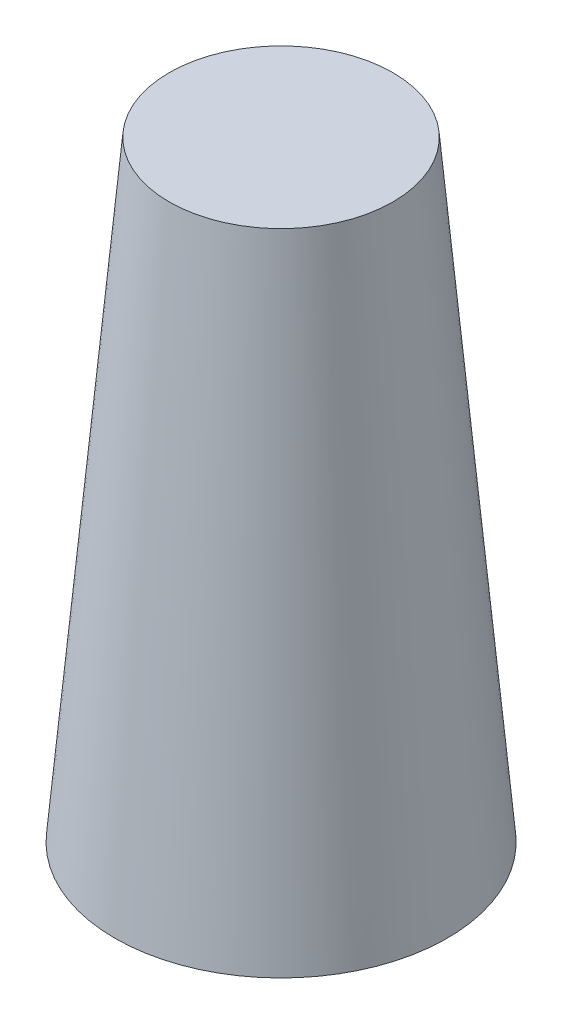
from build123d import *

# Parameters (mm, degrees)
SKETCH2_R = 4.191
SKETCH1_R = 6.223


with BuildPart() as part:
    # Sketch2 → Loft1 section 0
    with BuildSketch(Plane(origin=(0, 22.86, 0), x_dir=(1, 0, 0), z_dir=(0, 1, 0))):
        Circle(SKETCH2_R)
    # Sketch1 → Loft1 section 1
    with BuildSketch(Plane(origin=(0, 0, 0), x_dir=(1, 0, 0), z_dir=(0, 1, 0))):
        Circle(SKETCH1_R)
    loft()


solid = part.part
